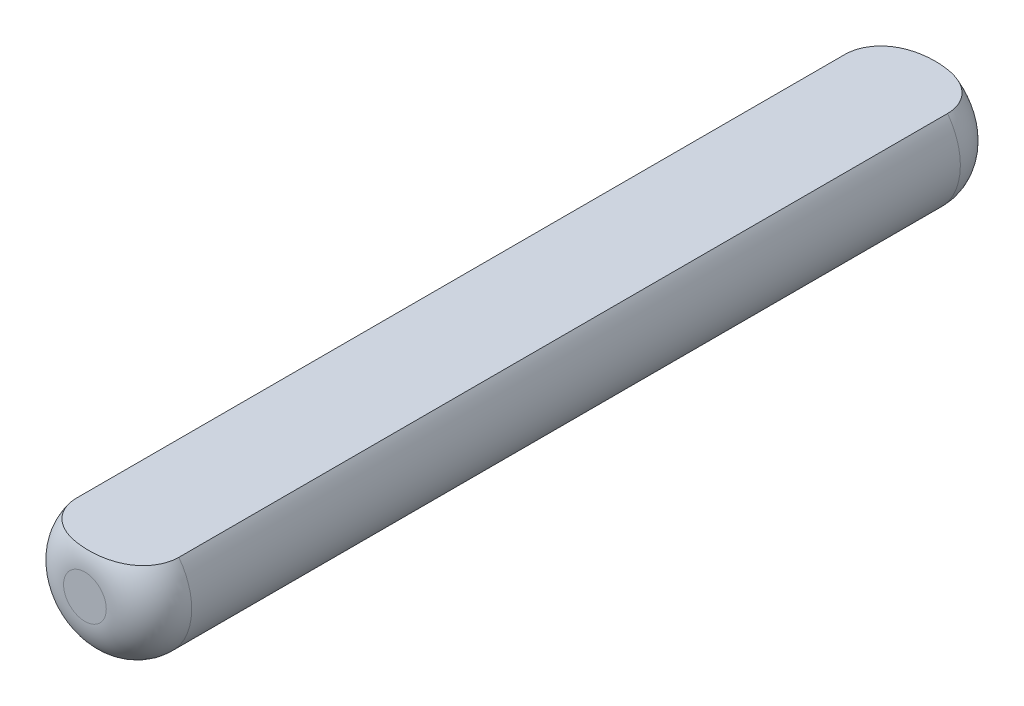
from build123d import *

# Parameters (mm, degrees)
ESQUISSE1_R             = 3
BOSS_EXTRU_1_DEPTH      = 40
CONG_1_R                = 2
ESQUISSE2_W             = 6
ESQUISSE2_H             = 1.2
ENL_V_MAT_EXTRU_1_DEPTH = 41.22437073


with BuildPart() as part:
    # Esquisse1 → Boss.-Extru.1 (new body)
    with BuildSketch(Plane.XY):
        Circle(ESQUISSE1_R)
    extrude(amount=BOSS_EXTRU_1_DEPTH)

    # Congé1
    cong_1_edges = [part.edges().sort_by_distance(p)[0] for p in [
        (-3, 0, 0),
        (-3, 0, 40),
    ]]
    fillet(cong_1_edges, radius=CONG_1_R)

    # Esquisse2 → Enlèv. mat.-Extru.1 (cut, through all)
    with BuildSketch(Plane.XY.offset(40)):
        with Locations((0, 2.4)):
            Rectangle(ESQUISSE2_W, ESQUISSE2_H)
    extrude(amount=-ENL_V_MAT_EXTRU_1_DEPTH, mode=Mode.SUBTRACT)


solid = part.part
